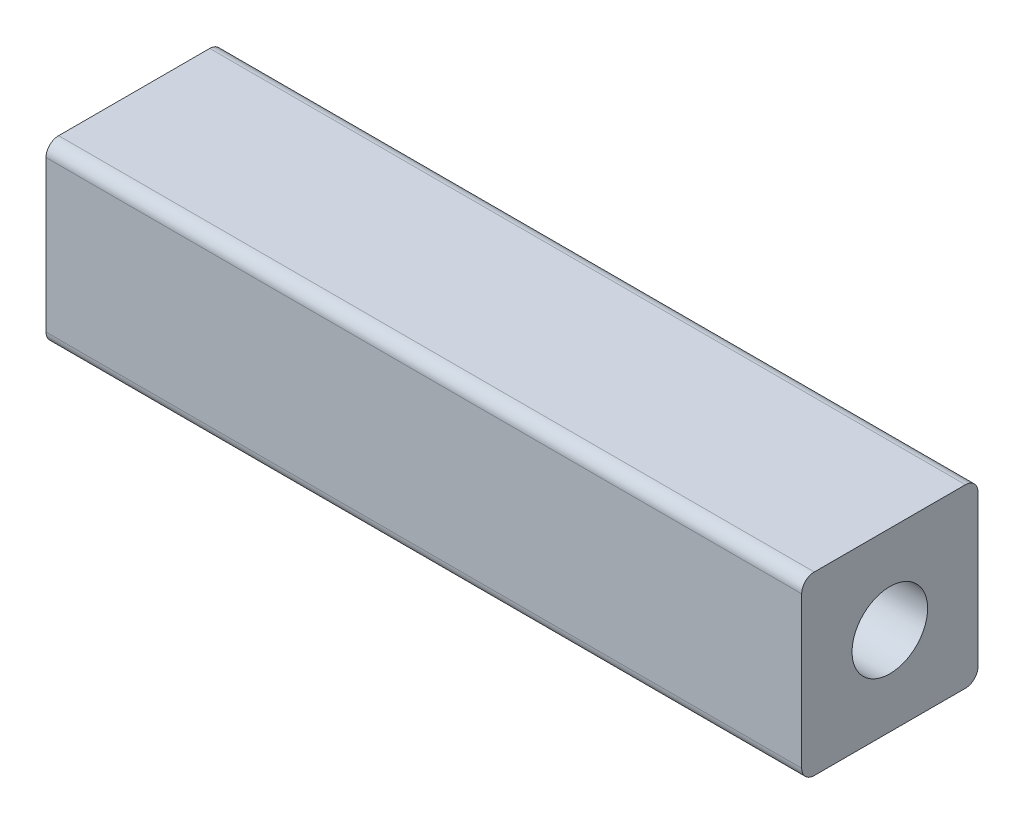
from build123d import *

# Parameters (mm, degrees)
SKETCH1_W           = 14
SKETCH1_H           = 14
BOSS_EXTRUDE1_DEPTH = 60
FILLET1_R           = 1
SKETCH2_R           = 3
CUT_EXTRUDE1_DEPTH  = 44


with BuildPart() as part:
    # Sketch1 → Boss-Extrude1 (new body)
    with BuildSketch(Plane(origin=(0, 0, 0), x_dir=(0, 0, -1), z_dir=(1, 0, 0))):
        Rectangle(SKETCH1_W, SKETCH1_H)
    extrude(amount=BOSS_EXTRUDE1_DEPTH)

    # Fillet1
    fillet1_edges = [part.edges().sort_by_distance(p)[0] for p in [
        (30, -7, -7),
        (30, -7, 7),
        (30, 7, 7),
        (30, 7, -7),
    ]]
    fillet(fillet1_edges, radius=FILLET1_R)

    # Sketch2 → Cut-Extrude1 (cut)
    with BuildSketch(Plane(origin=(60, 0, 0), x_dir=(0, 0, -1), z_dir=(1, 0, 0))):
        Circle(SKETCH2_R)
    extrude(amount=-CUT_EXTRUDE1_DEPTH, mode=Mode.SUBTRACT)


solid = part.part
